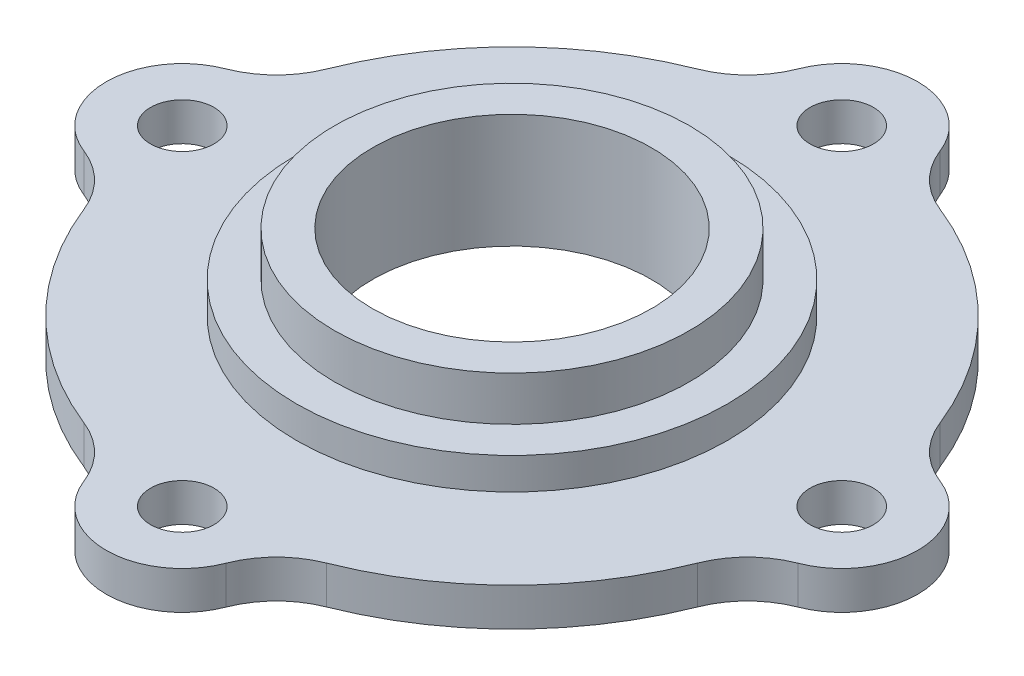
from build123d import *

# Parameters (mm, degrees)
SKETCH1_R           = 355.6
SKETCH1_R_2         = 279.4
BOSS_EXTRUDE2_DEPTH = 228.6
SKETCH2_R           = 431.8
BOSS_EXTRUDE3_DEPTH = 139.7
SKETCH3_R           = 63.5
BOSS_EXTRUDE4_DEPTH = 76.2
CUT_EXTRUDE1_REACH  = 1159.931
SKETCH4_R           = 279.4


with BuildPart() as part:
    # Sketch1 → Boss-Extrude2 (new body)
    with BuildSketch(Plane(origin=(0, 0, 0), x_dir=(1, 0, 0), z_dir=(0, 1, 0))):
        with Locations(Location((0, 0, 0), (0, 0, 270))):
            Circle(SKETCH1_R)
        with Locations(Location((0, 0, 0), (0, 0, 270))):
            Circle(SKETCH1_R_2, mode=Mode.SUBTRACT)
    extrude(amount=BOSS_EXTRUDE2_DEPTH)

    # Sketch2 → Boss-Extrude3 (add)
    with BuildSketch(Plane(origin=(0, 0, 0), x_dir=(1, 0, 0), z_dir=(0, 1, 0))):
        with Locations(Location((0, 0, 0), (0, 0, 270))):
            Circle(SKETCH2_R)
    extrude(amount=BOSS_EXTRUDE3_DEPTH)

    # Sketch3 → Boss-Extrude4 (add)
    with BuildSketch(Plane(origin=(0, 0, 0), x_dir=(1, 0, 0), z_dir=(0, 1, 0))):
        with BuildLine():
            ThreePointArc((-142.126171723, -715.408284024), (0, -812.8), (142.126171723, -715.408284024))
            ThreePointArc((142.126171723, -715.408284024), (181.782810221, -654.296173404), (242.619424457, -614.218181818))
            ThreePointArc((242.619424457, -614.218181818), (466.973318296, -466.973318296), (614.218181818, -242.619424457))
            ThreePointArc((614.218181818, -242.619424457), (654.296173404, -181.782810221), (715.408284024, -142.126171723))
            ThreePointArc((715.408284024, -142.126171723), (812.8, 0), (715.408284024, 142.126171723))
            ThreePointArc((715.408284024, 142.126171723), (654.296173404, 181.782810221), (614.218181818, 242.619424457))
            ThreePointArc((614.218181818, 242.619424457), (466.973318296, 466.973318296), (242.619424457, 614.218181818))
            ThreePointArc((242.619424457, 614.218181818), (181.782810221, 654.296173404), (142.126171723, 715.408284024))
            ThreePointArc((142.126171723, 715.408284024), (0, 812.8), (-142.126171723, 715.408284024))
            ThreePointArc((-142.126171723, 715.408284024), (-181.782810221, 654.296173404), (-242.619424457, 614.218181818))
            ThreePointArc((-242.619424457, 614.218181818), (-466.973318296, 466.973318296), (-614.218181818, 242.619424457))
            ThreePointArc((-614.218181818, 242.619424457), (-654.296173404, 181.782810221), (-715.408284024, 142.126171723))
            ThreePointArc((-715.408284024, 142.126171723), (-812.8, 0), (-715.408284024, -142.126171723))
            ThreePointArc((-715.408284024, -142.126171723), (-654.296173404, -181.782810221), (-614.218181818, -242.619424457))
            ThreePointArc((-614.218181818, -242.619424457), (-466.973318296, -466.973318296), (-242.619424457, -614.218181818))
            ThreePointArc((-242.619424457, -614.218181818), (-181.782810221, -654.296173404), (-142.126171723, -715.408284024))
        make_face()
        with Locations(Location((0, 660.4, 0), (0, 0, 90))):
            Circle(SKETCH3_R, mode=Mode.SUBTRACT)
        with Locations(Location((660.4, 0, 0), (0, 0, 90))):
            Circle(SKETCH3_R, mode=Mode.SUBTRACT)
        with Locations(Location((0, -660.4, 0), (0, 0, 90))):
            Circle(SKETCH3_R, mode=Mode.SUBTRACT)
        with Locations(Location((-660.4, 0, 0), (0, 0, 90))):
            Circle(SKETCH3_R, mode=Mode.SUBTRACT)
    extrude(amount=BOSS_EXTRUDE4_DEPTH)

    # Sketch4 → Cut-Extrude1 (cut, up to next)
    with BuildSketch(Plane(origin=(0, 139.7, 0), x_dir=(1, 0, 0), z_dir=(0, 1, 0)), mode=Mode.PRIVATE) as cut_extrude1_sk1:
        with Locations(Location((0, 0, 0), (0, 0, 270))):
            Circle(SKETCH4_R)
    cut_extrude1_tool1 = extrude(cut_extrude1_sk1.sketch, amount=-CUT_EXTRUDE1_REACH, mode=Mode.PRIVATE) & part.part
    add(cut_extrude1_tool1.solids().sort_by_distance((0, 139.7, 0))[0], mode=Mode.SUBTRACT)


solid = part.part
